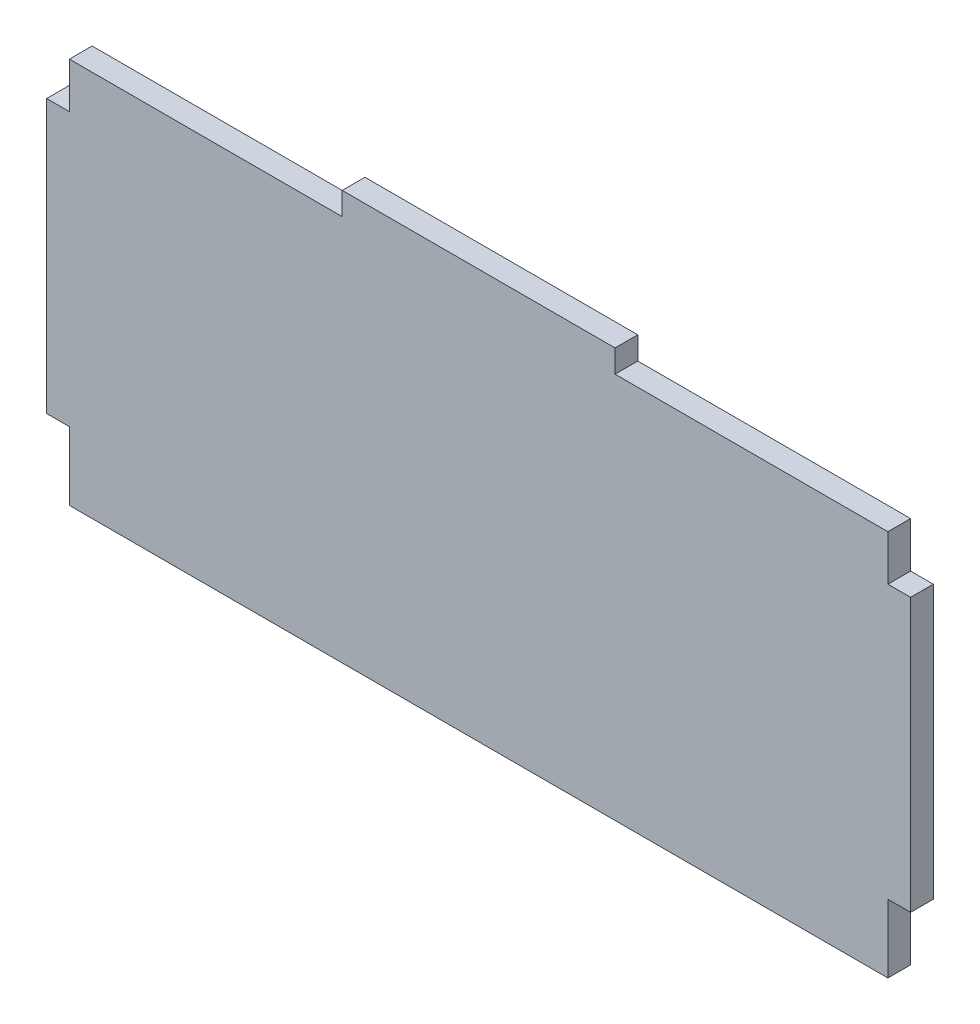
from build123d import *

# Parameters (mm, degrees)
SKETCH1_W           = 228.6
SKETCH1_H           = 107.95
SKETCH1_W_2         = 76.2
SKETCH1_H_2         = 6.35
SKETCH1_W_3         = 6.35
SKETCH1_H_3         = 76.2
BOSS_EXTRUDE1_DEPTH = 6.35


with BuildPart() as part:
    # Sketch1 → Boss-Extrude1 (new body)
    with BuildSketch(Plane.XY):
        with Locations((64.733678216, -34.923106362)):
            Rectangle(SKETCH1_W, SKETCH1_H)
        with Locations((64.733678216, 22.226893638)):
            Rectangle(SKETCH1_W_2, SKETCH1_H_2)
        Polygon((185.383678216, -69.848106362), (185.383678216, 2.969008236), (185.383678216, 6.351893638), (179.033678216, 6.351893638), (179.033678216, -69.848106362), align=None)
        with Locations((-52.741321784, -31.748106362)):
            Rectangle(SKETCH1_W_3, SKETCH1_H_3)
    extrude(amount=BOSS_EXTRUDE1_DEPTH)


solid = part.part
